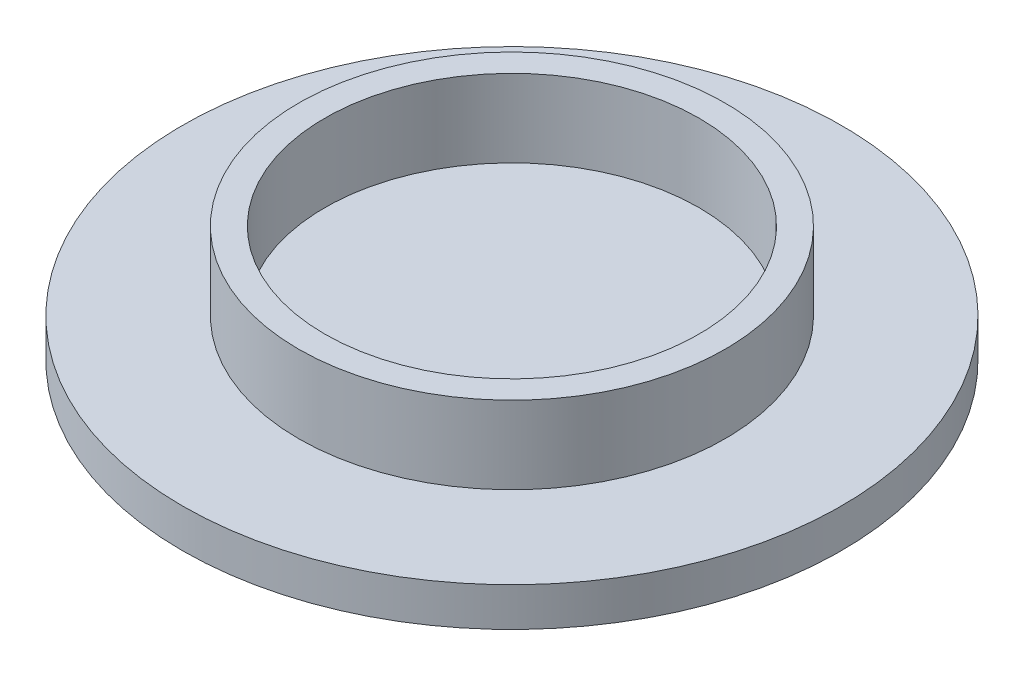
from build123d import *

# Parameters (mm, degrees)
SKETCH1_R           = 17
BOSS_EXTRUDE1_DEPTH = 1
SKETCH2_R           = 11
SKETCH2_R_2         = 9.652
BOSS_EXTRUDE2_DEPTH = 4


with BuildPart() as part:
    # Sketch1 → Boss-Extrude1 (new body)
    with BuildSketch(Plane(origin=(0, 0, 0), x_dir=(1, 0, 0), z_dir=(0, 1, 0))):
        with Locations(Location((0, 0, 0), (0, 0, 270))):
            Circle(SKETCH1_R)
    boss_extrude1 = extrude(amount=-BOSS_EXTRUDE1_DEPTH)

    # Sketch2 → Boss-Extrude2 (add)
    with BuildSketch(Plane(origin=(0, 0, 0), x_dir=(1, 0, 0), z_dir=(0, 1, 0))):
        with Locations(Location((0, 0, 0), (0, 0, 270))):
            Circle(SKETCH2_R)
        with Locations(Location((0, 0, 0), (0, 0, 270))):
            Circle(SKETCH2_R_2, mode=Mode.SUBTRACT)
    boss_extrude2 = extrude(amount=BOSS_EXTRUDE2_DEPTH)

    # Mirror1: Boss-Extrude1, Boss-Extrude2 across plane
    add(boss_extrude1.mirror(Plane.ZX.offset(-1)))
    add(boss_extrude2.mirror(Plane.ZX.offset(-1)))


solid = part.part
